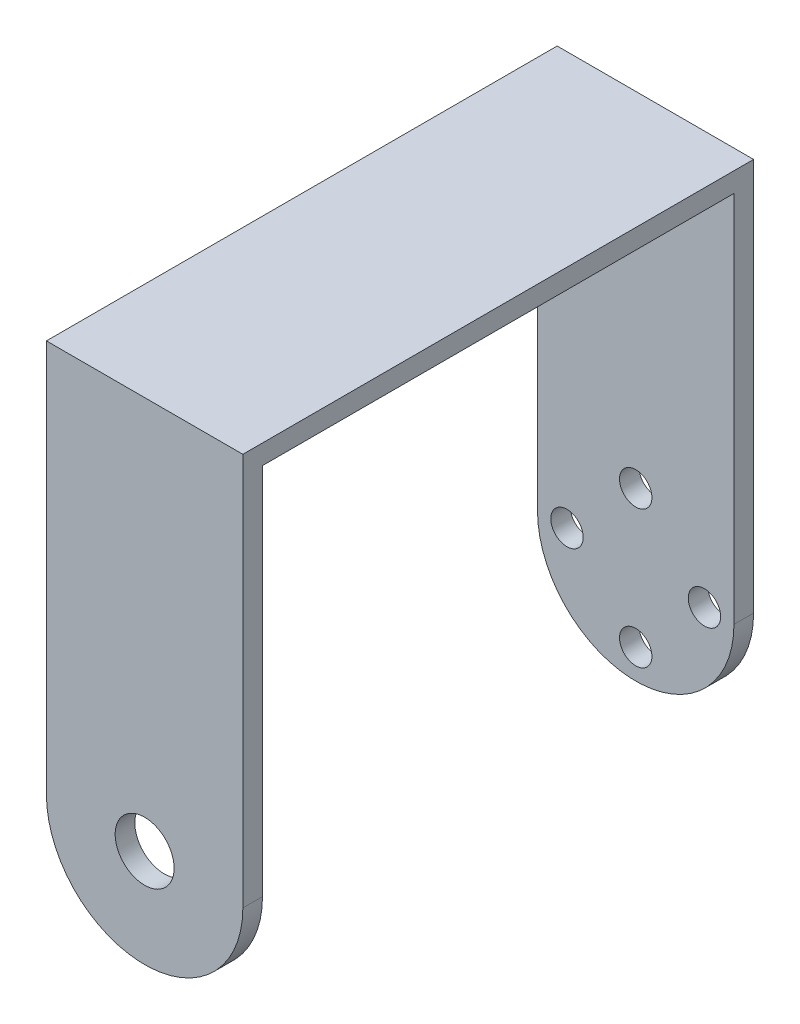
from build123d import *

# Parameters (mm, degrees)
EXTRUDE_1_DEPTH     = 2
SKETCH_2_W          = 20
SKETCH_2_H          = 2
EXTRUDE_2_DEPTH     = 50
CUT_EXTRUDE_1_REACH = 70.586
SKETCH_4_R          = 3
CUT_EXTRUDE_2_REACH = 70.586
SKETCH_5_R          = 1.65


with BuildPart() as part:
    # 草图1 → 凸台-拉伸1 (new body)
    with BuildSketch(Plane.XY):
        with BuildLine():
            Line((0, 0), (0, 40))
            Line((0, 40), (20, 40))
            Line((20, 40), (20, 0))
            ThreePointArc((20, 0), (10, -10), (0, 0))
        make_face()
    extrude_1 = extrude(amount=EXTRUDE_1_DEPTH)

    # 草图2 → 凸台-拉伸2 (add)
    with BuildSketch(Plane.XY.offset(2)):
        with Locations((10, 39)):
            Rectangle(SKETCH_2_W, SKETCH_2_H)
    extrude(amount=EXTRUDE_2_DEPTH)

    # 镜向1: 凸台-拉伸1 across plane
    add(extrude_1.mirror(Plane.XY.offset(26)))

    # 草图4 → 切除-拉伸1 (cut, up to next)
    with BuildSketch(Plane.XY.offset(52), mode=Mode.PRIVATE) as cut_extrude_1_sk1:
        with Locations((10, 0)):
            Circle(SKETCH_4_R)
    cut_extrude_1_tool1 = extrude(cut_extrude_1_sk1.sketch, amount=-CUT_EXTRUDE_1_REACH, mode=Mode.PRIVATE) & part.part
    add(cut_extrude_1_tool1.solids().sort_by_distance((10, 0, 52))[0], mode=Mode.SUBTRACT)

    # 草图5 → 切除-拉伸2 (cut, up to next)
    with BuildSketch(Plane(origin=(0, 0, 0), x_dir=(-1, 0, 0), z_dir=(0, 0, -1)), mode=Mode.PRIVATE) as cut_extrude_2_sk1:
        with Locations((-10, -7)):
            Circle(SKETCH_5_R)
    cut_extrude_2_tool1 = extrude(cut_extrude_2_sk1.sketch, amount=-CUT_EXTRUDE_2_REACH, mode=Mode.PRIVATE) & part.part
    # 草图5 → 切除-拉伸2 (cut, up to next)
    with BuildSketch(Plane(origin=(0, 0, 0), x_dir=(-1, 0, 0), z_dir=(0, 0, -1)), mode=Mode.PRIVATE) as cut_extrude_2_sk2:
        with Locations((-17, 0)):
            Circle(SKETCH_5_R)
    cut_extrude_2_tool2 = extrude(cut_extrude_2_sk2.sketch, amount=-CUT_EXTRUDE_2_REACH, mode=Mode.PRIVATE) & part.part
    # 草图5 → 切除-拉伸2 (cut, up to next)
    with BuildSketch(Plane(origin=(0, 0, 0), x_dir=(-1, 0, 0), z_dir=(0, 0, -1)), mode=Mode.PRIVATE) as cut_extrude_2_sk3:
        with Locations((-10, 7)):
            Circle(SKETCH_5_R)
    cut_extrude_2_tool3 = extrude(cut_extrude_2_sk3.sketch, amount=-CUT_EXTRUDE_2_REACH, mode=Mode.PRIVATE) & part.part
    # 草图5 → 切除-拉伸2 (cut, up to next)
    with BuildSketch(Plane(origin=(0, 0, 0), x_dir=(-1, 0, 0), z_dir=(0, 0, -1)), mode=Mode.PRIVATE) as cut_extrude_2_sk4:
        with Locations((-3, 0)):
            Circle(SKETCH_5_R)
    cut_extrude_2_tool4 = extrude(cut_extrude_2_sk4.sketch, amount=-CUT_EXTRUDE_2_REACH, mode=Mode.PRIVATE) & part.part
    add(cut_extrude_2_tool1.solids().sort_by_distance((10, -7, 0))[0], mode=Mode.SUBTRACT)
    add(cut_extrude_2_tool2.solids().sort_by_distance((17, 0, 0))[0], mode=Mode.SUBTRACT)
    add(cut_extrude_2_tool3.solids().sort_by_distance((10, 7, 0))[0], mode=Mode.SUBTRACT)
    add(cut_extrude_2_tool4.solids().sort_by_distance((3, 0, 0))[0], mode=Mode.SUBTRACT)


solid = part.part
